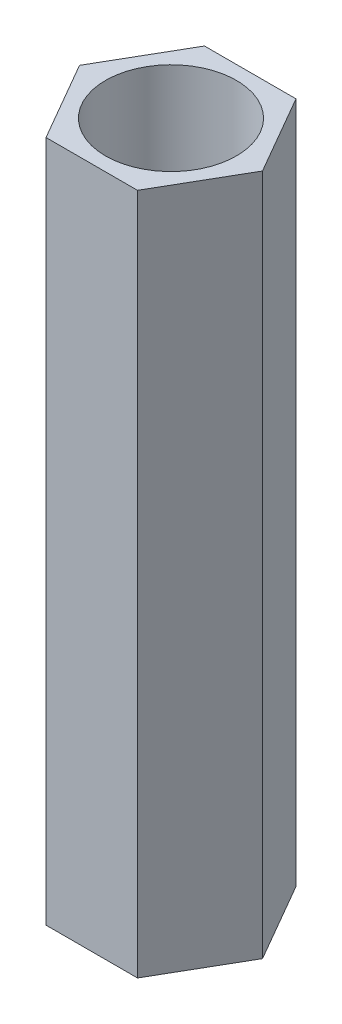
from build123d import *

# Parameters (mm, degrees)
BOSS_EXTRUDE1_DEPTH = 12.573
SKETCH2_R           = 1.2065
CUT_EXTRUDE1_DEPTH  = 13.769395819


with BuildPart() as part:
    # Sketch1 → Boss-Extrude1 (new body)
    with BuildSketch(Plane(origin=(0, 0, 0), x_dir=(1, 0, 0), z_dir=(0, 1, 0))):
        Polygon((-1.686440136, 0), (-0.843220068, -1.4605), (0.843220068, -1.4605), (1.686440136, 0), (0.843220068, 1.4605), (-0.843220068, 1.4605), align=None)
    extrude(amount=BOSS_EXTRUDE1_DEPTH)

    # Sketch2 → Cut-Extrude1 (cut, through all)
    with BuildSketch(Plane(origin=(0, 12.573, 0), x_dir=(1, 0, 0), z_dir=(0, 1, 0))):
        with Locations(Location((0, 0, 0), (0, 0, 270))):
            Circle(SKETCH2_R)
    extrude(amount=-CUT_EXTRUDE1_DEPTH, mode=Mode.SUBTRACT)


solid = part.part
